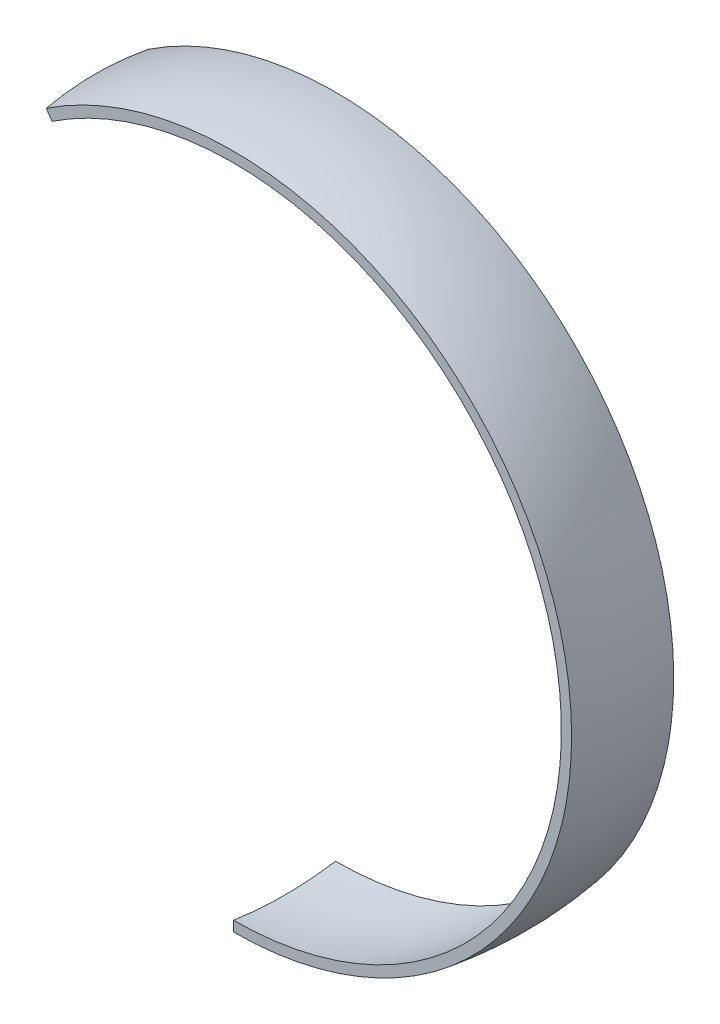
from build123d import *


with BuildPart() as part:
    # Sweep2: sweep along a path in Sketch2
    with BuildLine(Plane.XY) as sweep2_path:
        ThreePointArc((0, -164.117226875), (157.112621168, 47.435096993), (-90.821086438, 136.69672423))
    # Sketch1 → Sweep2 (sweep)
    with BuildSketch(Plane(origin=(0, 0, 0), x_dir=(0, 0, -1), z_dir=(1, 0, 0))):
        with BuildLine():
            Line((-25.4, -168.214453749), (-25.4, -163.134453749))
            ThreePointArc((-25.4, -163.134453749), (0, -165.1), (25.4, -163.134453749))
            Line((25.4, -163.134453749), (25.4, -168.214453749))
            ThreePointArc((25.4, -168.214453749), (0, -170.12131686), (-25.4, -168.214453749))
        make_face()
    sweep(path=sweep2_path.line)


solid = part.part
